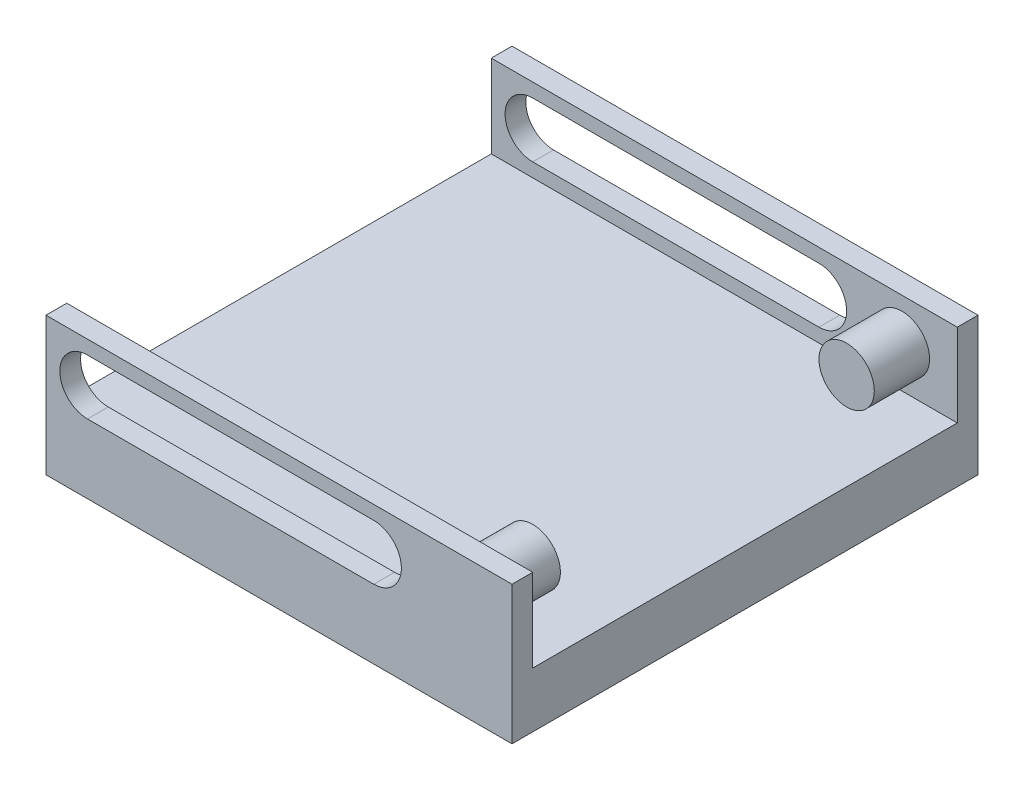
from build123d import *

# Parameters (mm, degrees)
SKETCH1_W               = 33.703234699
SKETCH1_H               = 30.703234699
BOSS_EXTRUDE1_DEPTH     = 4
SKETCH1_3_W             = 33.703234699
SKETCH1_3_H             = 1.5
BOSS_EXTRUDE2_DEPTH     = 10
SKETCH5_R               = 2
BOSS_EXTRUDE3_DEPTH     = 4
BOSS_EXTRUDE4_START     = 4
SKETCH4_R               = 2
BOSS_EXTRUDE4_DEPTH     = 4
CUT_EXTRUDE1_DEPTH      = 38
CUT_EXTRUDE1_DEPTH_BACK = 10


with BuildPart() as part:
    # Sketch1 → Boss-Extrude1 (new body)
    with BuildSketch(Plane(origin=(0, 0, 0), x_dir=(1, 0, 0), z_dir=(0, 1, 0))):
        with Locations((-16.851617349, -16.851617349)):
            Rectangle(SKETCH1_W, SKETCH1_H)
    extrude(amount=BOSS_EXTRUDE1_DEPTH)

    # Sketch1<3> → Boss-Extrude2 (add)
    with BuildSketch(Plane(origin=(0, 0, 0), x_dir=(1, 0, 0), z_dir=(0, 1, 0))):
        with Locations((-16.851617349, -32.953234699)):
            Rectangle(SKETCH1_3_W, SKETCH1_3_H)
        with Locations((-16.851617349, -0.75)):
            Rectangle(SKETCH1_3_W, SKETCH1_3_H)
    extrude(amount=BOSS_EXTRUDE2_DEPTH)

    # Sketch5 → Boss-Extrude3 (add)
    with BuildSketch(Plane(origin=(0, 0, 32.203234699), x_dir=(-1, 0, 0), z_dir=(0, 0, -1))):
        with Locations((4, 7)):
            Circle(SKETCH5_R)
    extrude(amount=BOSS_EXTRUDE3_DEPTH)

    # Sketch4 → Boss-Extrude4 (add)
    with BuildSketch(Plane.XY.offset(1.5).offset(BOSS_EXTRUDE4_START)):
        with Locations((-4, 7)):
            Circle(SKETCH4_R)
    extrude(amount=-BOSS_EXTRUDE4_DEPTH)

    # Sketch11 → Cut-Extrude1 (cut, two sides: drawn at the far end of the back side and taken through both)
    with BuildSketch(Plane(origin=(0, 0, 32.203234699), x_dir=(-1, 0, 0), z_dir=(0, 0, -1)).offset(-CUT_EXTRUDE1_DEPTH_BACK)):
        with BuildLine():
            ThreePointArc((30.703234699, 5), (32.703234699, 7), (30.703234699, 9))
            Line((30.703234699, 9), (10, 9))
            ThreePointArc((10, 9), (8, 7), (10, 5))
            Line((10, 5), (30.703234699, 5))
        make_face()
    extrude(amount=CUT_EXTRUDE1_DEPTH + CUT_EXTRUDE1_DEPTH_BACK, mode=Mode.SUBTRACT)


solid = part.part
